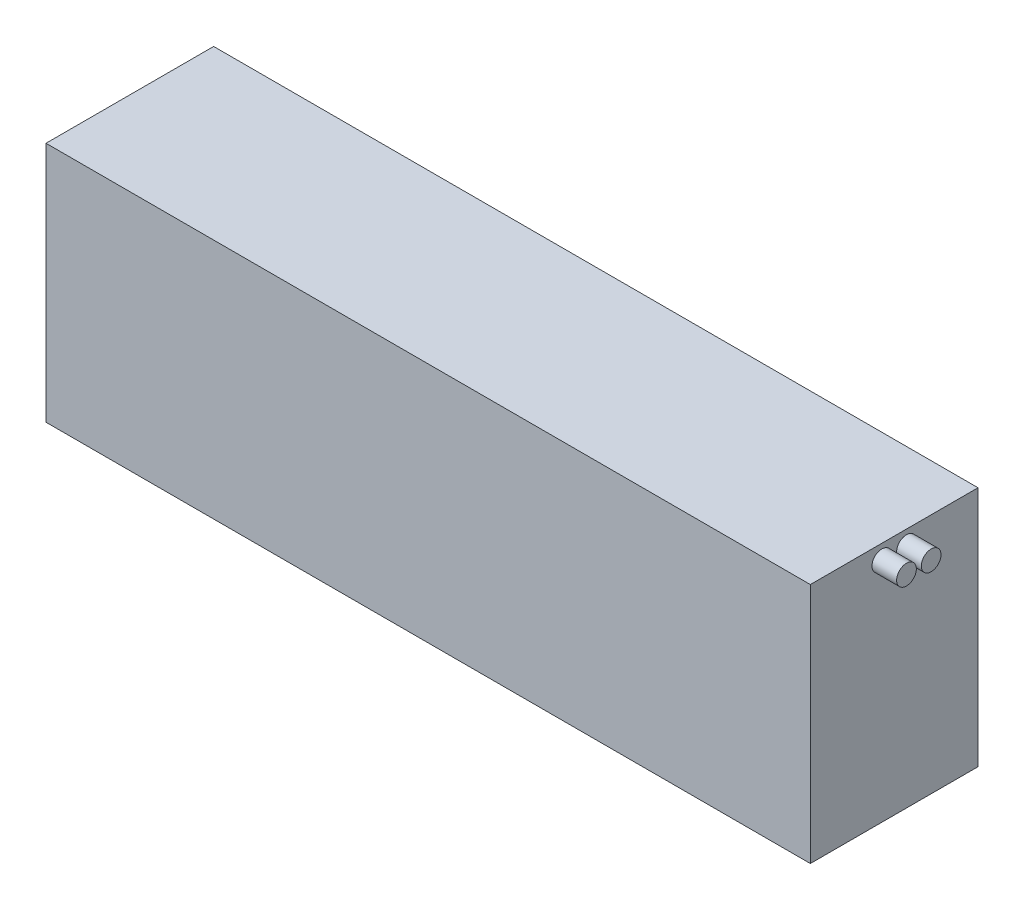
from build123d import *

# Parameters (mm, degrees)
ESQUISSE1_W        = 155
ESQUISSE1_H        = 34
BOSS_EXTRU_1_DEPTH = 49
ESQUISSE2_R        = 2
BOSS_EXTRU_2_DEPTH = 5


with BuildPart() as part:
    # Esquisse1 → Boss.-Extru.1 (new body)
    with BuildSketch(Plane(origin=(0, 0, 0), x_dir=(1, 0, 0), z_dir=(0, 1, 0))):
        with Locations((77.5, 17)):
            Rectangle(ESQUISSE1_W, ESQUISSE1_H)
    extrude(amount=BOSS_EXTRU_1_DEPTH)

    # Esquisse2 → Boss.-Extru.2 (add)
    with BuildSketch(Plane(origin=(155, 0, 0), x_dir=(0, 0, -1), z_dir=(1, 0, 0))):
        with Locations(Location((14.5, 46, 0), (0, 0, 180))):
            Circle(ESQUISSE2_R)
        with Locations(Location((19.5, 46, 0), (0, 0, 180))):
            Circle(ESQUISSE2_R)
    extrude(amount=BOSS_EXTRU_2_DEPTH)


solid = part.part
